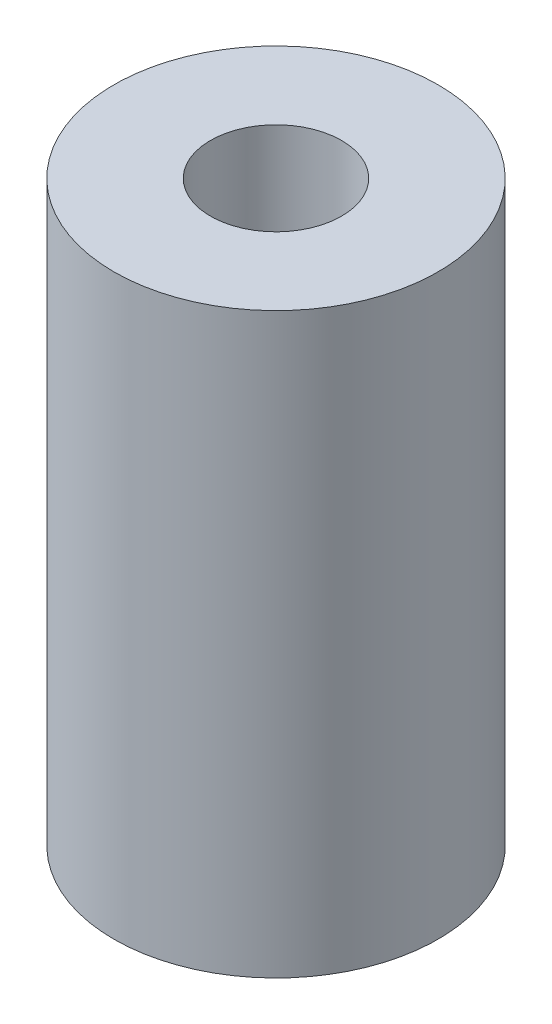
from build123d import *

# Parameters (mm, degrees)
SKETCH2_R      = 42.7355
SKETCH2_R_2    = 17.2974
EXTRUDE1_DEPTH = 152.4


with BuildPart() as part:
    # Sketch2 → Extrude1 (new body)
    with BuildSketch(Plane(origin=(0, 0, 0), x_dir=(1, 0, 0), z_dir=(0, 1, 0))):
        with Locations(Location((0, 0, 0), (0, 0, 90))):
            Circle(SKETCH2_R)
        with Locations(Location((0, 0, 0), (0, 0, 90))):
            Circle(SKETCH2_R_2, mode=Mode.SUBTRACT)
    extrude(amount=EXTRUDE1_DEPTH)


solid = part.part
